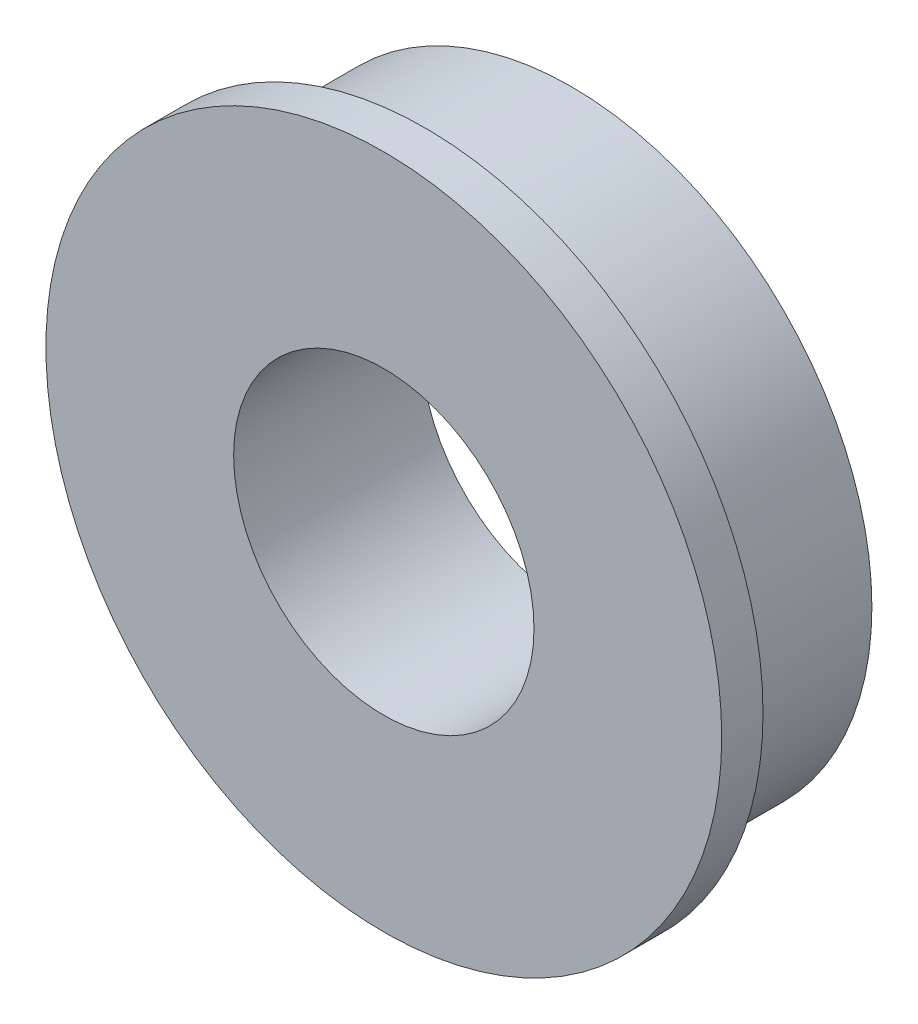
from build123d import *

# Parameters (mm, degrees)
CROQUIS1_R              = 9
SALIENTE_EXTRUIR1_DEPTH = 1.1
CROQUIS2_R              = 8
SALIENTE_EXTRUIR2_DEPTH = 3.9
CROQUIS3_R              = 4
CORTAR_EXTRUIR1_DEPTH   = 5


with BuildPart() as part:
    # Croquis1 → Saliente-Extruir1 (new body)
    with BuildSketch(Plane.XY):
        Circle(CROQUIS1_R)
    extrude(amount=SALIENTE_EXTRUIR1_DEPTH)

    # Croquis2 → Saliente-Extruir2 (add)
    with BuildSketch(Plane(origin=(0, 0, 0), x_dir=(-1, 0, 0), z_dir=(0, 0, -1))):
        with Locations(Location((0, 0, 0), (0, 0, 180))):
            Circle(CROQUIS2_R)
    extrude(amount=SALIENTE_EXTRUIR2_DEPTH)

    # Croquis3 → Cortar-Extruir1 (cut)
    with BuildSketch(Plane(origin=(0, 0, -3.9), x_dir=(-1, 0, 0), z_dir=(0, 0, -1))):
        Circle(CROQUIS3_R)
    extrude(amount=-CORTAR_EXTRUIR1_DEPTH, mode=Mode.SUBTRACT)


solid = part.part
